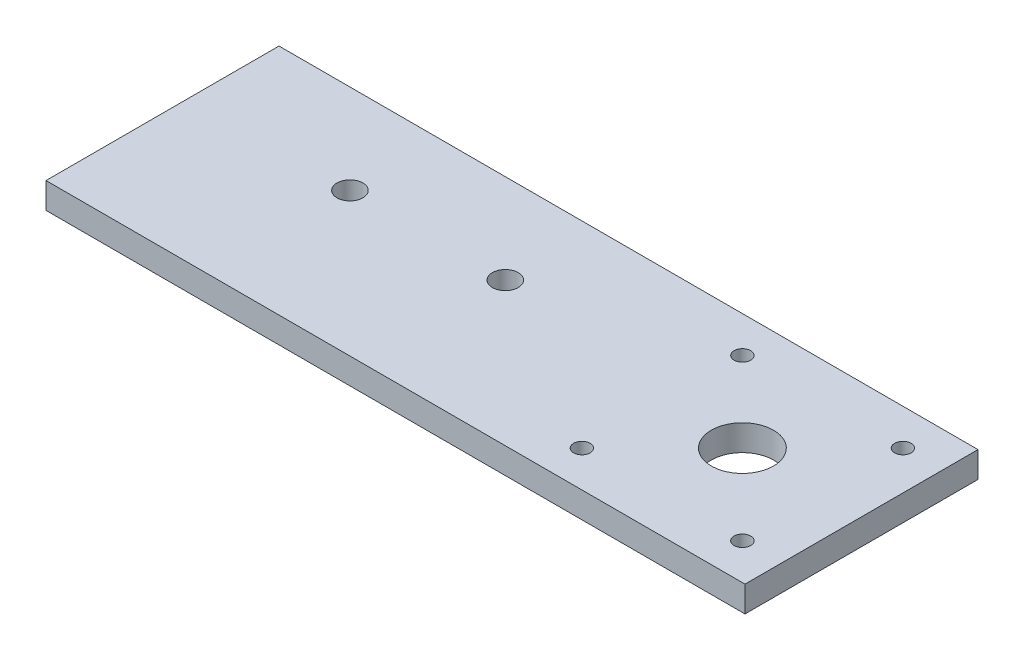
from build123d import *

# Parameters (mm, degrees)
SKETCH1_W           = 135
SKETCH1_H           = 45
BOSS_EXTRUDE1_DEPTH = 5
CUT_EXTRUDE2_REACH  = 73.327
SKETCH3_R           = 2.5
SKETCH4_R           = 6
SKETCH4_R_2         = 1.6
CUT_EXTRUDE3_DEPTH  = 72.326713088


with BuildPart() as part:
    # Sketch1 → Boss-Extrude1 (new body)
    with BuildSketch(Plane(origin=(0, 0, 0), x_dir=(1, 0, 0), z_dir=(0, 1, 0))):
        Rectangle(SKETCH1_W, SKETCH1_H)
    extrude(amount=BOSS_EXTRUDE1_DEPTH)

    # Sketch3 → Cut-Extrude2 (cut, up to next)
    with BuildSketch(Plane.XZ, mode=Mode.PRIVATE) as cut_extrude2_sk1:
        with Locations(Location((-36.498729637, -5.198729637, 0), (0, 0, 270))):
            Circle(SKETCH3_R)
    cut_extrude2_tool1 = extrude(cut_extrude2_sk1.sketch, amount=-CUT_EXTRUDE2_REACH, mode=Mode.PRIVATE) & part.part
    # Sketch3 → Cut-Extrude2 (cut, up to next)
    with BuildSketch(Plane.XZ, mode=Mode.PRIVATE) as cut_extrude2_sk2:
        with Locations(Location((-6.496188911, -5.198729637, 0), (0, 0, 270))):
            Circle(SKETCH3_R)
    cut_extrude2_tool2 = extrude(cut_extrude2_sk2.sketch, amount=-CUT_EXTRUDE2_REACH, mode=Mode.PRIVATE) & part.part
    add(cut_extrude2_tool1.solids().sort_by_distance((-36.49873, 0, -5.19873))[0], mode=Mode.SUBTRACT)
    add(cut_extrude2_tool2.solids().sort_by_distance((-6.496189, 0, -5.19873))[0], mode=Mode.SUBTRACT)

    # Sketch4 → Cut-Extrude3 (cut, through all)
    with BuildSketch(Plane.XZ):
        with Locations(Location((44.5, 0.002540726, 0), (0, 0, 270))):
            Circle(SKETCH4_R)
        with Locations(Location((60, 15.502540726, 0), (0, 0, 270))):
            Circle(SKETCH4_R_2)
        with Locations(Location((29, 15.502540726, 0), (0, 0, 270))):
            Circle(SKETCH4_R_2)
        with Locations(Location((29, -15.497459274, 0), (0, 0, 270))):
            Circle(SKETCH4_R_2)
        with Locations(Location((60, -15.497459274, 0), (0, 0, 270))):
            Circle(SKETCH4_R_2)
    extrude(amount=-CUT_EXTRUDE3_DEPTH, mode=Mode.SUBTRACT)


solid = part.part
